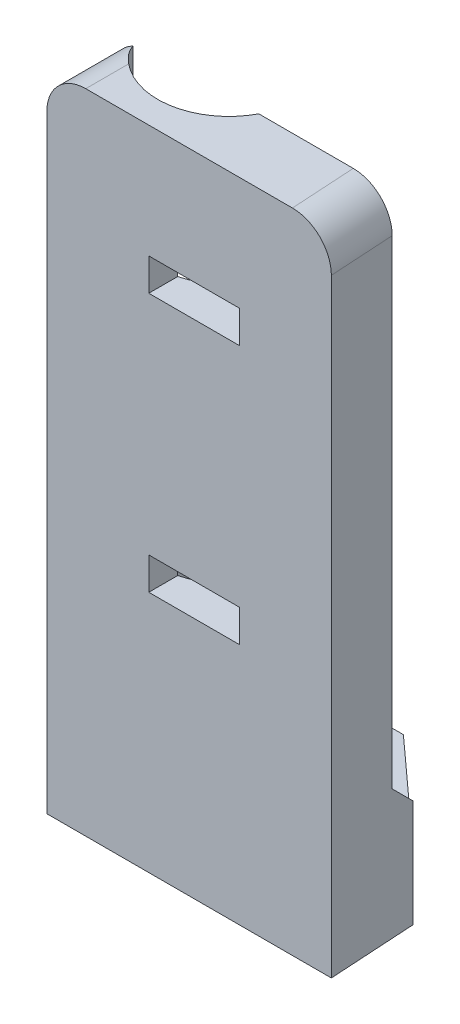
from build123d import *

# Parameters (mm, degrees)
SKETCH1_R               = 3.25
BOSS_EXTRUDE1_DEPTH     = 50
CHAMFER4_SIZE           = 7
CHAMFER4_SIZE2          = 10
SKETCH2_R               = 5.5
CUT_EXTRUDE1_DEPTH      = 45
CUT_EXTRUDE3_DEPTH      = 56.397262251
CUT_EXTRUDE3_DEPTH_BACK = 50
CUT_EXTRUDE4_DEPTH      = 45
CHAMFER5_SIZE           = 5
FILLET1_R               = 3
SKETCH6_R               = 5.5
SKETCH6_R_2             = 3.25
BOSS_EXTRUDE2_DEPTH     = 11
SKETCH9_W               = 7
SKETCH9_H               = 2.5
CUT_EXTRUDE5_DEPTH      = 15


with BuildPart() as part:
    # Sketch1 → Boss-Extrude1 (new body)
    with BuildSketch(Plane(origin=(0, 0, 0), x_dir=(1, 0, 0), z_dir=(0, 1, 0))):
        Polygon((-5.320759509, 8), (-22.469015665, -7.56), (22.469015665, -7.56), (5.320759509, 8), align=None)
        with Locations(Location((0, 0, 0), (0, 0, 270))):
            Circle(SKETCH1_R, mode=Mode.SUBTRACT)
    extrude(amount=BOSS_EXTRUDE1_DEPTH)

    # Chamfer4
    chamfer4_edges = [part.edges().sort_by_distance(p)[0] for p in [
        (22.469015665, 25, 7.56),
    ]]
    chamfer4_side = [part.faces().sort_by_distance(p)[0] for p in [
        (0, 25, 7.56),
    ]]
    chamfer(chamfer4_edges, length=CHAMFER4_SIZE, length2=CHAMFER4_SIZE2, reference=chamfer4_side[0])

    # Sketch2 → Cut-Extrude1 (cut)
    with BuildSketch(Plane(origin=(0, 50, 0), x_dir=(1, 0, 0), z_dir=(0, 1, 0))):
        with Locations(Location((0, 0, 0), (0, 0, 270))):
            Circle(SKETCH2_R)
    extrude(amount=-CUT_EXTRUDE1_DEPTH, mode=Mode.SUBTRACT)

    # Sketch4 → Cut-Extrude3 (cut, two sides: drawn at the far end of the back side and taken through both)
    with BuildSketch(Plane.XZ.offset(-CUT_EXTRUDE3_DEPTH_BACK)):
        with BuildLine():
            Line((-6.5, 0), (-6.5, 8.455296228))
            Line((-6.5, 8.455296228), (-18.092934759, 18.509530088))
            Line((-18.092934759, 18.509530088), (-27.843988074, 13.266508324))
            Line((-27.843988074, 13.266508324), (-26.239796982, -3.957148404))
            Line((-26.239796982, -3.957148404), (-22.051551969, -11.746511534))
            Line((-22.051551969, -11.746511534), (6.44529607, -11.904202977))
            Line((6.44529607, -11.904202977), (12.131507072, -6.5))
            Line((12.131507072, -6.5), (0, -6.5))
            ThreePointArc((0, -6.5), (-4.596194078, -4.596194078), (-6.5, 0))
        make_face()
    extrude(amount=CUT_EXTRUDE3_DEPTH + CUT_EXTRUDE3_DEPTH_BACK, mode=Mode.SUBTRACT)

    # Sketch5 → Cut-Extrude4 (cut)
    with BuildSketch(Plane(origin=(0, 50, 0), x_dir=(1, 0, 0), z_dir=(0, 1, 0))):
        Polygon((0, 0), (4.867894822, -2.56), (20.482845708, -2.56), (8.2569175, 8.380042473), (1.341376292, 8.380042473), (-9.589048862, 8.380042473), (-9.589048862, -2.56), (-4.867894822, -2.56), align=None)
    extrude(amount=-CUT_EXTRUDE4_DEPTH, mode=Mode.SUBTRACT)

    # Chamfer5
    chamfer5_edges = [part.edges().sort_by_distance(p)[0] for p in [
        (10.017520214, 5, 2.56),
        (-5.683947411, 5, 2.56),
    ]]
    chamfer(chamfer5_edges, length=CHAMFER5_SIZE)

    # Fillet1
    fillet1_edges = [part.edges().sort_by_distance(p)[0] for p in [
        (15.318080635, 50, 5.06),
        (-6.5, 50, 5.06),
    ]]
    fillet(fillet1_edges, radius=FILLET1_R)

    # Sketch6 → Boss-Extrude2 (add)
    with BuildSketch(Plane(origin=(0, 5, 0), x_dir=(1, 0, 0), z_dir=(0, 1, 0))):
        Circle(SKETCH6_R)
        with Locations(Location((0, 0, 0), (0, 0, 270))):
            Circle(SKETCH6_R_2, mode=Mode.SUBTRACT)
    extrude(amount=BOSS_EXTRUDE2_DEPTH)

    # Sketch9 → Cut-Extrude5 (cut)
    with BuildSketch(Plane.XY.offset(7.56)):
        with Locations((4.867894822, 40)):
            Rectangle(SKETCH9_W, SKETCH9_H)
        with Locations((4.867894822, 20)):
            Rectangle(SKETCH9_W, SKETCH9_H)
    extrude(amount=-CUT_EXTRUDE5_DEPTH, mode=Mode.SUBTRACT)


solid = part.part
